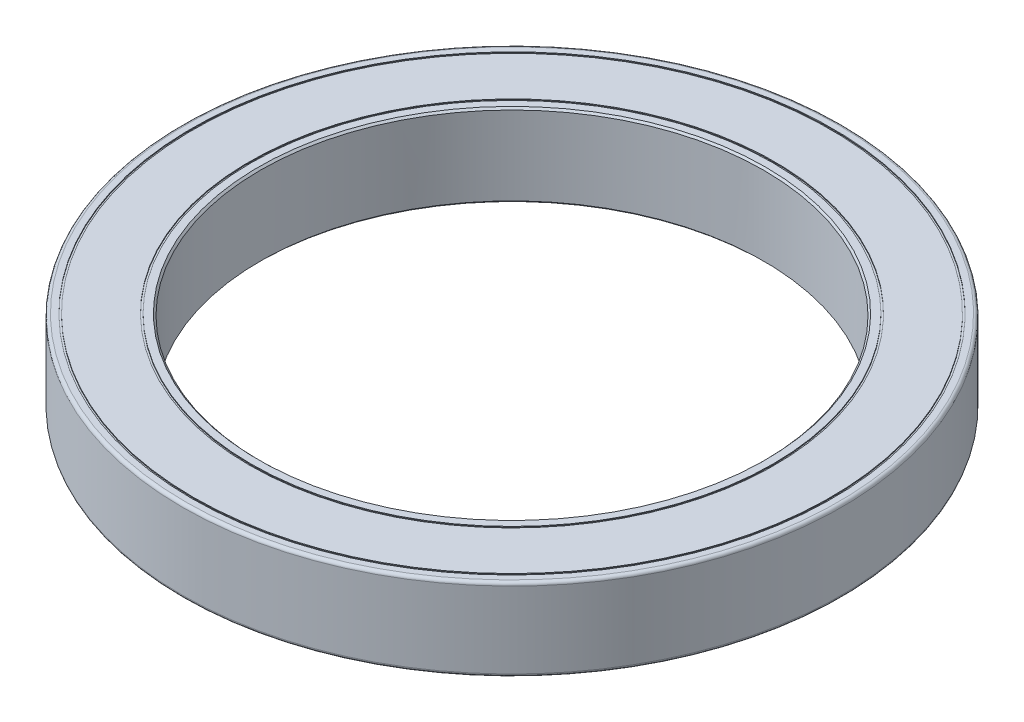
from build123d import *

# Parameters (mm, degrees)
FILLET2_R     = 0.344
CHAMFER2_SIZE = 0.2


with BuildPart() as part:
    # Sketch1 → Revolve1 (revolve)
    with BuildSketch(Plane.XY, mode=Mode.PRIVATE) as revolve1_sk:
        Polygon((36, 0), (36, 9), (35, 9), (35, 8.9), (34.8, 8.9), (34.8, 9), (28.7, 9), (28.7, 8.9), (28.5, 8.9), (28.5, 9), (27.5, 9), (27.5, 0), (28.5, 0), (28.5, 0.1), (28.7, 0.1), (28.7, 0), (34.8, 0), (34.8, 0.1), (35, 0.1), (35, 0), align=None)
    revolve(revolve1_sk.sketch.rotate(Axis((0, 4.5, 0), (0, -1, 0)), 90), axis=Axis((0, 4.5, 0), (0, -1, 0)))

    # Fillet2
    fillet2_edges = [part.edges().sort_by_distance(p)[0] for p in [
        (0, 0, -36),
        (0, 9, -36),
    ]]
    fillet(fillet2_edges, radius=FILLET2_R)

    # Chamfer2
    chamfer2_edges = [part.edges().sort_by_distance(p)[0] for p in [
        (0, 9, -27.5),
        (0, 0, -27.5),
    ]]
    chamfer(chamfer2_edges, length=CHAMFER2_SIZE)


solid = part.part
